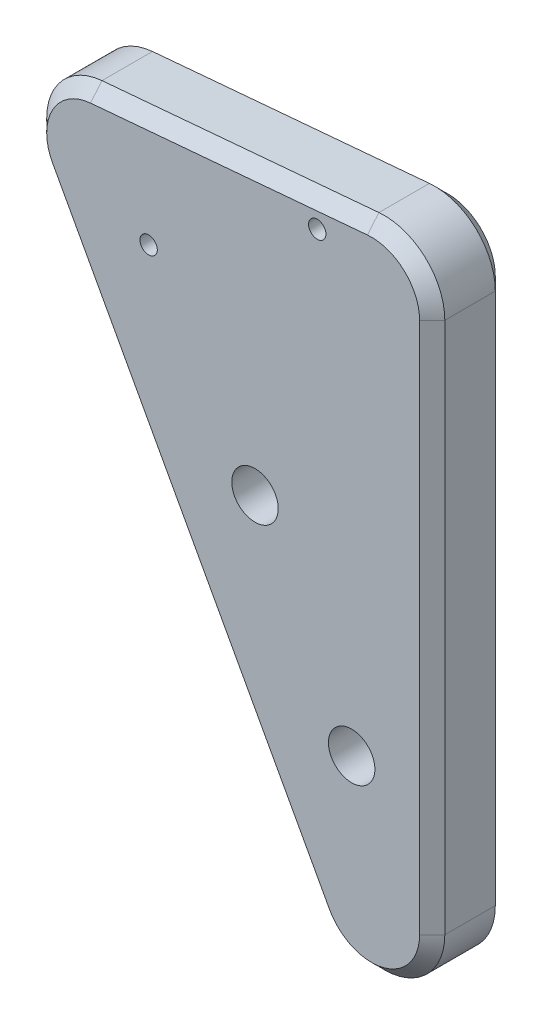
from build123d import *

# Parameters (mm, degrees)
SKETCH1_R           = 2.921
SKETCH1_R_2         = 1.0922
BOSS_EXTRUDE1_DEPTH = 9.525
FILLET1_R           = 7.62
CHAMFER1_SIZE       = 1.5875


with BuildPart() as part:
    # Sketch1 → Boss-Extrude1 (new body)
    with BuildSketch(Plane.XY):
        Polygon((0, 0), (54.714479363, -100.353454091), (54.714479363, 4.786896675), align=None)
        with Locations(Location((44.587010065, -55.247724238, 0), (0, 0, 180))):
            Circle(SKETCH1_R, mode=Mode.SUBTRACT)
        with Locations(Location((32.428236873, -32.946956662, 0), (0, 0, 180))):
            Circle(SKETCH1_R, mode=Mode.SUBTRACT)
        with Locations(Location((40.257483915, -0.047509878, 0), (0, 0, 180))):
            Circle(SKETCH1_R_2, mode=Mode.SUBTRACT)
        with Locations(Location((19.05, -12.35670409, 0), (0, 0, 180))):
            Circle(SKETCH1_R_2, mode=Mode.SUBTRACT)
    extrude(amount=BOSS_EXTRUDE1_DEPTH)

    # Fillet1
    fillet1_edges = [part.edges().sort_by_distance(p)[0] for p in [
        (54.714479363, 4.786896675, 4.7625),
        (54.714479363, -100.353454091, 4.7625),
        (0, 0, 4.7625),
    ]]
    fillet(fillet1_edges, radius=FILLET1_R)

    # Chamfer1
    chamfer1_edges = [part.edges().sort_by_distance(p)[0] for p in [
        (54.714479363, -36.993938617, 0),
        (54.714479363, -36.993938617, 9.525),
        (29.01531101, 2.538510782, 0),
        (22.989207497, -42.165189288, 0),
        (52.242476745, 2.089179203, 0),
        (5.548863872, -2.975274703, 0),
        (48.97661184, -77.842903003, 0),
        (22.989207497, -42.165189288, 9.525),
        (29.01531101, 2.538510782, 9.525),
        (52.242476745, 2.089179203, 9.525),
        (5.548863872, -2.975274703, 9.525),
        (48.97661184, -77.842903003, 9.525),
    ]]
    chamfer(chamfer1_edges, length=CHAMFER1_SIZE)


solid = part.part
